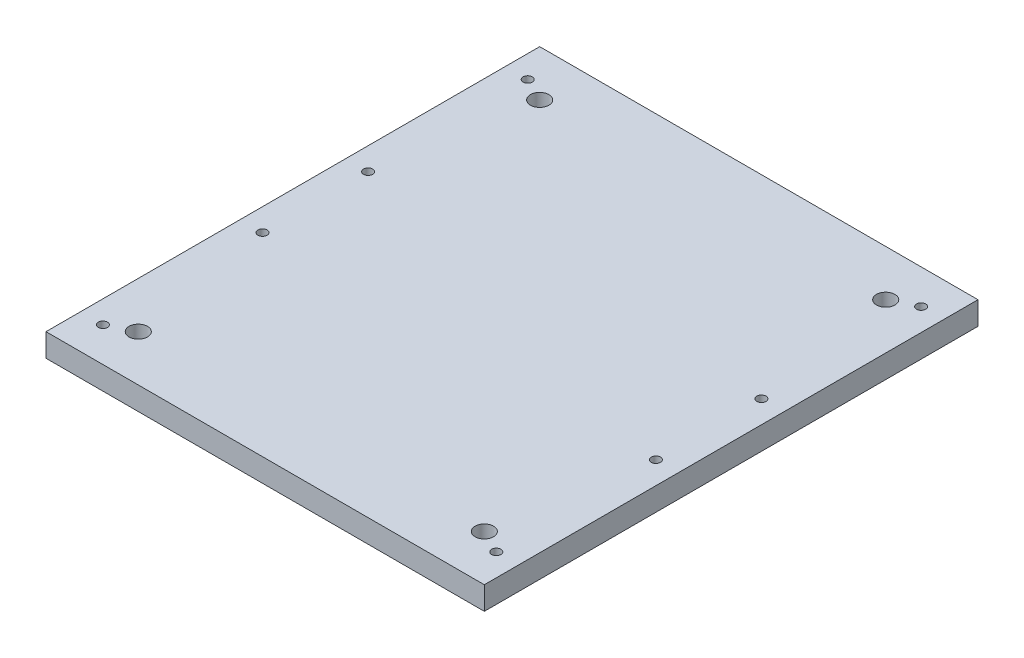
from build123d import *

# Parameters (mm, degrees)
SKETCH2_R                                  = 2
BOSS_EXTRUDE1_DEPTH                        = 5
CUT_EXTRUDE1_REACH                         = 73.718
SKETCH4_R                                  = 1
MIRROR2_COPY_1_REACH                       = 73.718
MIRROR2_COPY_1_SKETCH_R                    = 1
MIRROR2_AT_THE_SECOND_PLANE_COPY_1_REACH   = 73.718
MIRROR2_AT_THE_SECOND_PLANE_COPY_1_SKETC_R = 1
MIRROR2_AT_THE_SECOND_PLANE_COPY_2_REACH   = 73.718
MIRROR2_AT_THE_SECOND_PLANE_COPY_2_SKETC_R = 1
MIRROR2_AT_THE_SECOND_PLANE_COPY_3_REACH   = 73.718
MIRROR2_AT_THE_SECOND_PLANE_COPY_3_SKETC_R = 1


with BuildPart() as part:
    # Sketch2 → Boss-Extrude1 (new body)
    # profile 1 of 2: a face of its own
    with BuildSketch(Plane(origin=(0, 0, 0), x_dir=(1, 0, 0), z_dir=(0, 1, 0))):
        with BuildLine():
            ThreePointArc((37.5, -45.5), (36.085786438, -42.085786438), (39.5, -43.5))
            Line((39.5, -43.5), (47.5, -43.5))
            Line((47.5, -43.5), (47.5, 53.5))
            Line((47.5, 53.5), (-47.5, 53.5))
            Line((-47.5, 53.5), (-47.5, -53.5))
            Line((-47.5, -53.5), (37.5, -53.5))
            Line((37.5, -53.5), (37.5, -45.5))
        make_face()
        with Locations(Location((-37.5, -43.5, 0), (0, 0, 270))):
            Circle(SKETCH2_R, mode=Mode.SUBTRACT)
        with Locations(Location((-37.5, 43.5, 0), (0, 0, 270))):
            Circle(SKETCH2_R, mode=Mode.SUBTRACT)
        with Locations(Location((37.5, 43.5, 0), (0, 0, 270))):
            Circle(SKETCH2_R, mode=Mode.SUBTRACT)
    # profile 2 of 2: a face of its own
    with BuildSketch(Plane(origin=(0, 0, 0), x_dir=(1, 0, 0), z_dir=(0, 1, 0))):
        with BuildLine():
            Line((47.5, -43.5), (39.5, -43.5))
            ThreePointArc((39.5, -43.5), (38.914213562, -44.914213562), (37.5, -45.5))
            Line((37.5, -45.5), (37.5, -53.5))
            Line((37.5, -53.5), (47.5, -53.5))
            Line((47.5, -53.5), (47.5, -43.5))
        make_face()
    extrude(amount=BOSS_EXTRUDE1_DEPTH)

    # Sketch4 → Cut-Extrude1 (cut, up to next)
    with BuildSketch(Plane(origin=(0, 5, 0), x_dir=(1, 0, 0), z_dir=(0, 1, 0)), mode=Mode.PRIVATE) as cut_extrude1_sk1:
        with Locations(Location((42.63, 46.04, 0), (0, 0, 270))):
            Circle(SKETCH4_R)
    cut_extrude1_tool1 = extrude(cut_extrude1_sk1.sketch, amount=-CUT_EXTRUDE1_REACH, mode=Mode.PRIVATE) & part.part
    cut_extrude1 = cut_extrude1_tool1.solids().sort_by_distance((42.63, 5, -46.04))[0]
    add(cut_extrude1, mode=Mode.SUBTRACT)

    # Mirror1: Cut-Extrude1 across plane
    add(cut_extrude1.mirror(Plane(origin=(0, 0, -28.738611276), x_dir=(1, 0, 0), z_dir=(0, 0, -1))), mode=Mode.SUBTRACT)

    # Mirror2: Cut-Extrude1 across plane
    add(cut_extrude1.mirror(Plane(origin=(0, 0, 0), x_dir=(0, 0, 1), z_dir=(1, 0, 0))), mode=Mode.SUBTRACT)

    # Mirror2 copy 1 sketch → Mirror2 copy 1 (cut, up to next)
    with BuildSketch(Plane(origin=(0, 5, -57.477222552), x_dir=(-1, 0, 0), z_dir=(0, 1, 0)), mode=Mode.PRIVATE) as mirror2_copy_1_sk1:
        with Locations(Location((42.63, 46.04, 0), (0, 0, 270))):
            Circle(MIRROR2_COPY_1_SKETCH_R)
    mirror2_copy_1_tool1 = extrude(mirror2_copy_1_sk1.sketch, amount=-MIRROR2_COPY_1_REACH, mode=Mode.PRIVATE) & part.part
    add(mirror2_copy_1_tool1.solids().sort_by_distance((-42.63, 5, -11.437222552))[0], mode=Mode.SUBTRACT)

    # Mirror2 at the second plane: Cut-Extrude1 across plane
    add(cut_extrude1.mirror(Plane.XY), mode=Mode.SUBTRACT)

    # Mirror2 at the second plane copy 1 sketc → Mirror2 at the second plane copy 1 (cut, up to next)
    with BuildSketch(Plane(origin=(0, 5, 57.477222552), x_dir=(1, 0, 0), z_dir=(0, 1, 0)), mode=Mode.PRIVATE) as mirror2_at_the_second_plane_copy_1_sk1:
        with Locations(Location((42.63, 46.04, 0), (0, 0, 270))):
            Circle(MIRROR2_AT_THE_SECOND_PLANE_COPY_1_SKETC_R)
    mirror2_at_the_second_plane_copy_1_tool1 = extrude(mirror2_at_the_second_plane_copy_1_sk1.sketch, amount=-MIRROR2_AT_THE_SECOND_PLANE_COPY_1_REACH, mode=Mode.PRIVATE) & part.part
    add(mirror2_at_the_second_plane_copy_1_tool1.solids().sort_by_distance((42.63, 5, 11.437222552))[0], mode=Mode.SUBTRACT)

    # Mirror2 at the second plane copy 2 sketc → Mirror2 at the second plane copy 2 (cut, up to next)
    with BuildSketch(Plane(origin=(0, 5, 0), x_dir=(-1, 0, 0), z_dir=(0, 1, 0)), mode=Mode.PRIVATE) as mirror2_at_the_second_plane_copy_2_sk1:
        with Locations(Location((42.63, 46.04, 0), (0, 0, 270))):
            Circle(MIRROR2_AT_THE_SECOND_PLANE_COPY_2_SKETC_R)
    mirror2_at_the_second_plane_copy_2_tool1 = extrude(mirror2_at_the_second_plane_copy_2_sk1.sketch, amount=-MIRROR2_AT_THE_SECOND_PLANE_COPY_2_REACH, mode=Mode.PRIVATE) & part.part
    add(mirror2_at_the_second_plane_copy_2_tool1.solids().sort_by_distance((-42.63, 5, 46.04))[0], mode=Mode.SUBTRACT)

    # Mirror2 at the second plane copy 3 sketc → Mirror2 at the second plane copy 3 (cut, up to next)
    with BuildSketch(Plane(origin=(0, 5, 57.477222552), x_dir=(-1, 0, 0), z_dir=(0, 1, 0)), mode=Mode.PRIVATE) as mirror2_at_the_second_plane_copy_3_sk1:
        with Locations((42.63, -46.04)):
            Circle(MIRROR2_AT_THE_SECOND_PLANE_COPY_3_SKETC_R)
    mirror2_at_the_second_plane_copy_3_tool1 = extrude(mirror2_at_the_second_plane_copy_3_sk1.sketch, amount=-MIRROR2_AT_THE_SECOND_PLANE_COPY_3_REACH, mode=Mode.PRIVATE) & part.part
    add(mirror2_at_the_second_plane_copy_3_tool1.solids().sort_by_distance((-42.63, 5, 11.437222552))[0], mode=Mode.SUBTRACT)


solid = part.part
